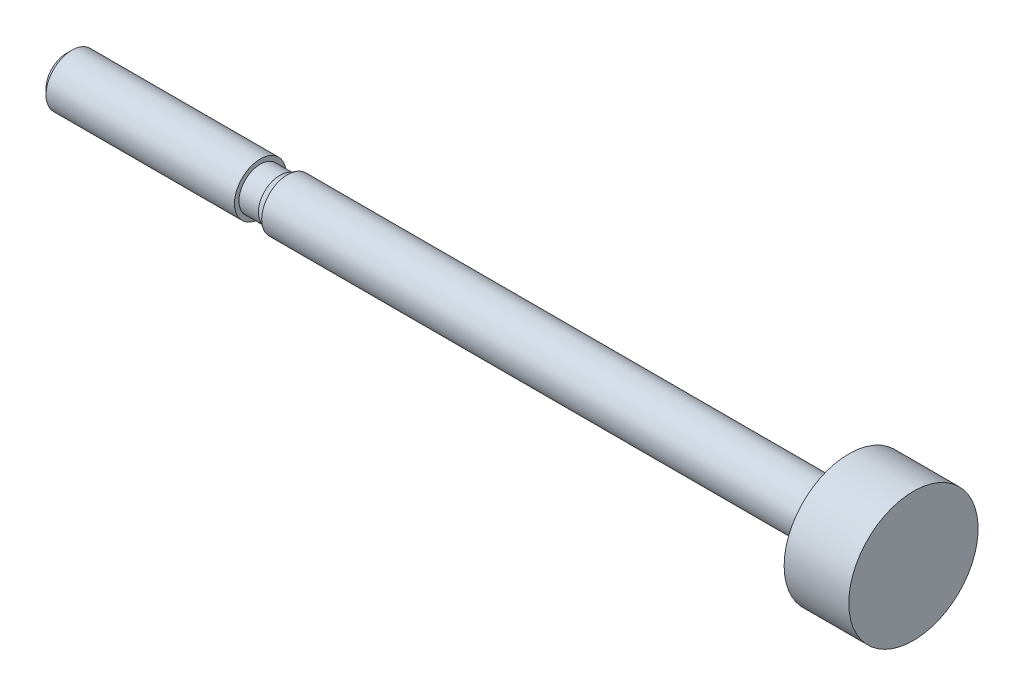
from build123d import *


with BuildPart() as part:
    # 草图1 → 旋转1 (revolve)
    with BuildSketch(Plane.XY, mode=Mode.PRIVATE) as revolve_1_sk:
        Polygon((0, 0), (0, 1.5705), (0.4295, 2), (15, 2), (15, 1.65), (16.5, 1.65), (17.106217783, 2), (60.5, 2), (60.5, 5), (65.5, 5), (65.5, 0), align=None)
    revolve(revolve_1_sk.sketch.rotate(Axis((65.5, 0, 0), (-1, 0, 0)), 270), axis=Axis((65.5, 0, 0), (-1, 0, 0)))


solid = part.part
